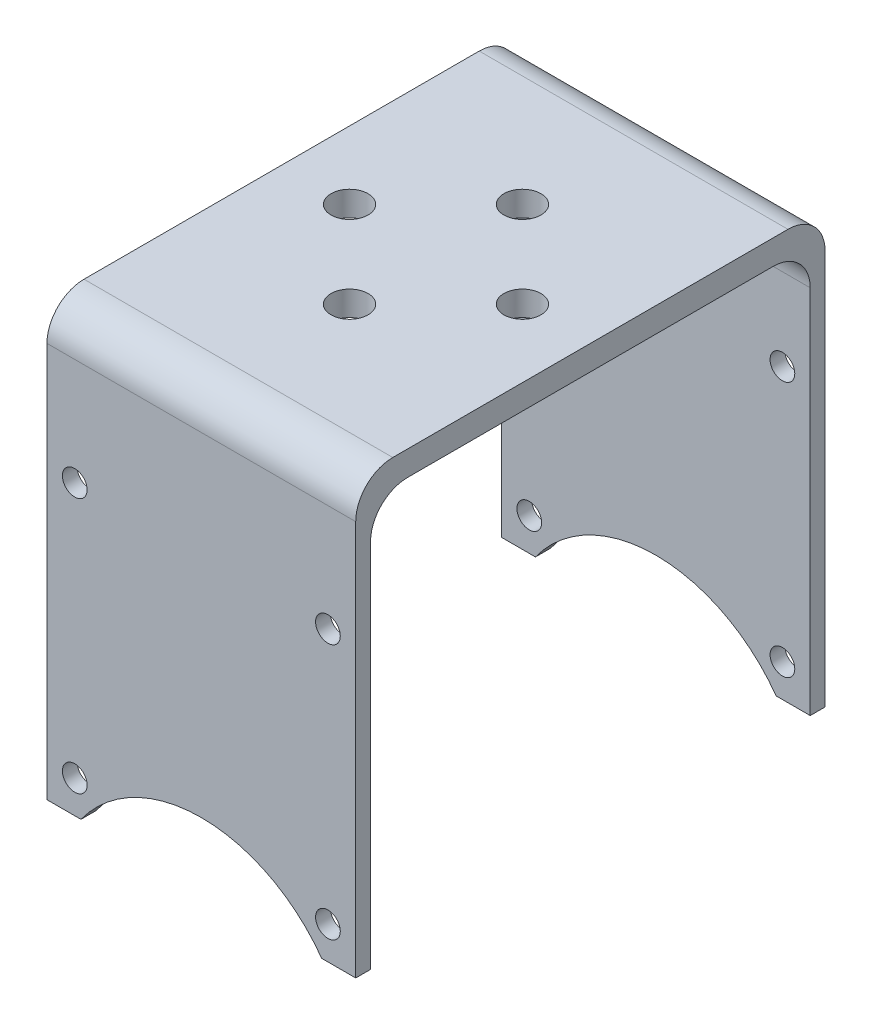
from build123d import *

# Parameters (mm, degrees)
EXTRUDE_1_DEPTH      = 2
SKETCH_4_W           = 25
SKETCH_4_H           = 1.2
EXTRUDE_3_DEPTH      = 40
FILLET_2_R           = 3
SKETCH_7_R           = 1
CUT_EXTRUDE_3_DEPTH  = 59.857879676
SKETCH_8_OUTSIDE_W   = 56.19
SKETCH_8_OUTSIDE_H   = 53.19
SKETCH_8_OUTSIDE_W_2 = 25
SKETCH_8_OUTSIDE_H_2 = 38
CUT_EXTRUDE_4_DEPTH  = 10
SKETCH_9_R           = 1.5
CUT_EXTRUDE_5_DEPTH  = 10


with BuildPart() as part:
    # 草图1 → 凸台-拉伸1 (new body)
    with BuildSketch(Plane(origin=(0, 0, 0), x_dir=(1, 0, 0), z_dir=(0, 1, 0))):
        Polygon((12.5, -10), (12.5, -19), (-12.5, -19), (-12.5, -10), (-20.5, -10), (-20.5, 10), (-12.5, 10), (-12.5, 19), (12.5, 19), (12.5, 10), (20.5, 10), (20.5, -10), align=None)
    extrude(amount=EXTRUDE_1_DEPTH)

    # 草图4 → 凸台-拉伸3 (add)
    with BuildSketch(Plane.XZ):
        with Locations((0, 18.4)):
            Rectangle(SKETCH_4_W, SKETCH_4_H)
        with Locations((0, -18.4)):
            Rectangle(SKETCH_4_W, SKETCH_4_H)
    extrude(amount=EXTRUDE_3_DEPTH)

    # 圆角2
    fillet_2_edges = [part.edges().sort_by_distance(p)[0] for p in [
        (0, 2, -19),
        (0, 2, 19),
        (0, 0, 17.8),
        (0, 0, -17.8),
    ]]
    fillet(fillet_2_edges, radius=FILLET_2_R)

    # 草图7 → 切除-拉伸3 (cut, through all)
    with BuildSketch(Plane.XY.offset(19)):
        with Locations((-10.25, -30.35)):
            Circle(SKETCH_7_R)
        with Locations((-10.25, -9.65)):
            Circle(SKETCH_7_R)
        with Locations((10.25, -9.65)):
            Circle(SKETCH_7_R)
        with Locations((10.25, -30.35)):
            Circle(SKETCH_7_R)
        with BuildLine():
            Line((-12.5, -33), (-9.746794345, -33))
            ThreePointArc((-9.746794345, -33), (0, -28), (9.746794345, -33))
            Line((9.746794345, -33), (12.5, -33))
            Line((12.5, -33), (12.5, -40))
            Line((12.5, -40), (-12.5, -40))
            Line((-12.5, -40), (-12.5, -33))
        make_face()
    extrude(amount=-CUT_EXTRUDE_3_DEPTH, mode=Mode.SUBTRACT)

    # 草图8 outside → 切除-拉伸4 (cut)
    with BuildSketch(Plane(origin=(0, 2, 0), x_dir=(1, 0, 0), z_dir=(0, 1, 0))):
        Rectangle(SKETCH_8_OUTSIDE_W, SKETCH_8_OUTSIDE_H)
        Rectangle(SKETCH_8_OUTSIDE_W_2, SKETCH_8_OUTSIDE_H_2, mode=Mode.SUBTRACT)
    extrude(amount=-CUT_EXTRUDE_4_DEPTH, mode=Mode.SUBTRACT)

    # 草图9 → 切除-拉伸5 (cut)
    with BuildSketch(Plane(origin=(0, 2, 0), x_dir=(1, 0, 0), z_dir=(0, 1, 0))):
        with Locations(Location((0, -7, 0), (0, 0, 270))):
            Circle(SKETCH_9_R)
        with Locations(Location((-7, 0, 0), (0, 0, 270))):
            Circle(SKETCH_9_R)
        with Locations(Location((0, 7, 0), (0, 0, 270))):
            Circle(SKETCH_9_R)
        with Locations(Location((7, 0, 0), (0, 0, 270))):
            Circle(SKETCH_9_R)
    extrude(amount=-CUT_EXTRUDE_5_DEPTH, mode=Mode.SUBTRACT)


solid = part.part
